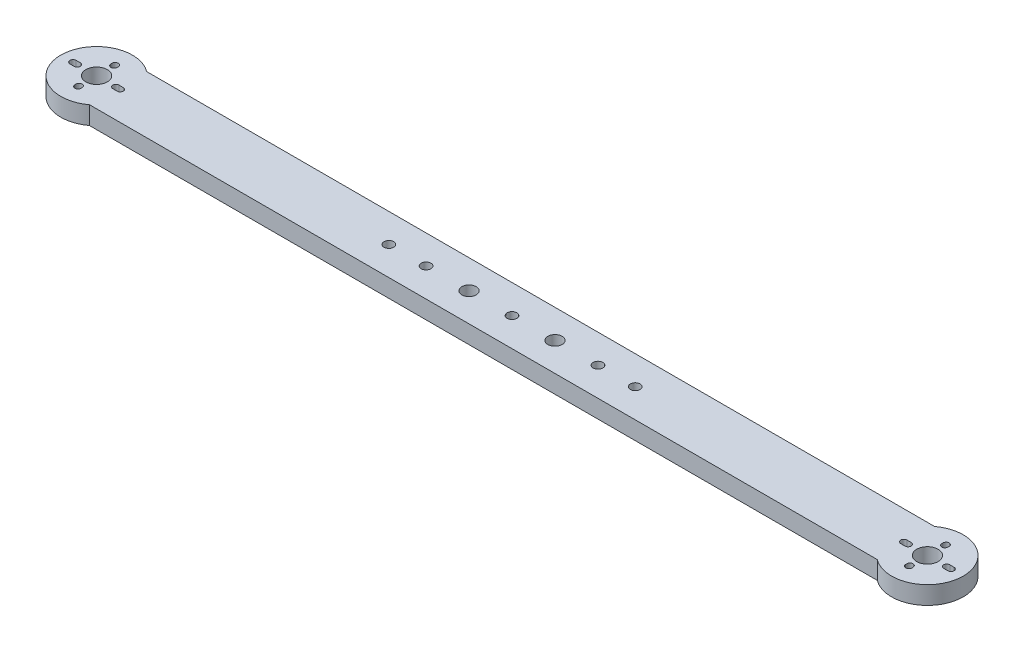
from build123d import *

# Parameters (mm, degrees)
BOSS_EXTRUDE1_DEPTH = 8
SKETCH2_R           = 4.75
CUT_EXTRUDE1_DEPTH  = 201.81338663
SKETCH3_R           = 2.159
CUT_EXTRUDE2_DEPTH  = 201.81338663
SKETCH4_R           = 3.175
CUT_EXTRUDE3_DEPTH  = 201.81338663
SKETCH5_R           = 2.159
CUT_EXTRUDE4_DEPTH  = 201.81338663


with BuildPart() as part:
    # Sketch1 → Boss-Extrude1 (new body)
    with BuildSketch(Plane(origin=(0, 0, 0), x_dir=(1, 0, 0), z_dir=(0, 1, 0))):
        with BuildLine():
            Line((-174.625, 12.7), (174.625, 12.7))
            ThreePointArc((174.625, 12.7), (200.025, 0), (174.625, -12.7))
            Line((174.625, -12.7), (-174.625, -12.7))
            ThreePointArc((-174.625, -12.7), (-200.025, 0), (-174.625, 12.7))
        make_face()
    extrude(amount=BOSS_EXTRUDE1_DEPTH)

    # Sketch2 → Cut-Extrude1 (cut, through all)
    with BuildSketch(Plane(origin=(0, 8, 0), x_dir=(1, 0, 0), z_dir=(0, 1, 0))):
        with Locations(Location((184.15, 0, 0), (0, 0, 270))):
            Circle(SKETCH2_R)
        with Locations(Location((-184.15, 0, 0), (0, 0, 90))):
            Circle(SKETCH2_R)
        with BuildLine():
            Line((173.691383345, 1.375), (175.608616655, 1.375))
            ThreePointArc((175.608616655, 1.375), (176.983616655, 0), (175.608616655, -1.375))
            Line((175.608616655, -1.375), (173.691383345, -1.375))
            ThreePointArc((173.691383345, -1.375), (172.316383345, 0), (173.691383345, 1.375))
        make_face()
        with BuildLine():
            Line((194.608616655, 1.375), (192.691383345, 1.375))
            ThreePointArc((192.691383345, 1.375), (191.316383345, 0), (192.691383345, -1.375))
            Line((192.691383345, -1.375), (194.608616655, -1.375))
            ThreePointArc((194.608616655, -1.375), (195.983616655, 0), (194.608616655, 1.375))
        make_face()
        with BuildLine():
            Line((185.525, 8.25), (185.525, 7.75))
            ThreePointArc((185.525, 7.75), (184.15, 6.375), (182.775, 7.75))
            Line((182.775, 7.75), (182.775, 8.25))
            ThreePointArc((182.775, 8.25), (184.15, 9.625), (185.525, 8.25))
        make_face()
        with BuildLine():
            Line((185.525, -8.25), (185.525, -7.75))
            ThreePointArc((185.525, -7.75), (184.15, -6.375), (182.775, -7.75))
            Line((182.775, -7.75), (182.775, -8.25))
            ThreePointArc((182.775, -8.25), (184.15, -9.625), (185.525, -8.25))
        make_face()
        with BuildLine():
            Line((-185.525, -8.25), (-185.525, -7.75))
            ThreePointArc((-185.525, -7.75), (-184.15, -6.375), (-182.775, -7.75))
            Line((-182.775, -7.75), (-182.775, -8.25))
            ThreePointArc((-182.775, -8.25), (-184.15, -9.625), (-185.525, -8.25))
        make_face()
        with BuildLine():
            Line((-185.525, 8.25), (-185.525, 7.75))
            ThreePointArc((-185.525, 7.75), (-184.15, 6.375), (-182.775, 7.75))
            Line((-182.775, 7.75), (-182.775, 8.25))
            ThreePointArc((-182.775, 8.25), (-184.15, 9.625), (-185.525, 8.25))
        make_face()
        with BuildLine():
            Line((-194.608616655, 1.375), (-192.691383345, 1.375))
            ThreePointArc((-192.691383345, 1.375), (-191.316383345, 0), (-192.691383345, -1.375))
            Line((-192.691383345, -1.375), (-194.608616655, -1.375))
            ThreePointArc((-194.608616655, -1.375), (-195.983616655, 0), (-194.608616655, 1.375))
        make_face()
        with BuildLine():
            Line((-173.691383345, 1.375), (-175.608616655, 1.375))
            ThreePointArc((-175.608616655, 1.375), (-176.983616655, 0), (-175.608616655, -1.375))
            Line((-175.608616655, -1.375), (-173.691383345, -1.375))
            ThreePointArc((-173.691383345, -1.375), (-172.316383345, 0), (-173.691383345, 1.375))
        make_face()
    extrude(amount=-CUT_EXTRUDE1_DEPTH, mode=Mode.SUBTRACT)

    # Sketch3 → Cut-Extrude2 (cut, through all)
    with BuildSketch(Plane(origin=(0, 8, 0), x_dir=(1, 0, 0), z_dir=(0, 1, 0))):
        with Locations(Location((0, 0, 0), (0, 0, 270))):
            Circle(SKETCH3_R)
        with Locations(Location((38.1, 0, 0), (0, 0, 270))):
            Circle(SKETCH3_R)
        with Locations(Location((-38.1, 0, 0), (0, 0, 270))):
            Circle(SKETCH3_R)
    extrude(amount=-CUT_EXTRUDE2_DEPTH, mode=Mode.SUBTRACT)

    # Sketch4 → Cut-Extrude3 (cut, through all)
    with BuildSketch(Plane(origin=(0, 8, 0), x_dir=(1, 0, 0), z_dir=(0, 1, 0))):
        with Locations(Location((-19.05, 0, 0), (0, 0, 270))):
            Circle(SKETCH4_R)
        with Locations(Location((19.05, 0, 0), (0, 0, 270))):
            Circle(SKETCH4_R)
    extrude(amount=-CUT_EXTRUDE3_DEPTH, mode=Mode.SUBTRACT)

    # Sketch5 → Cut-Extrude4 (cut, through all)
    with BuildSketch(Plane(origin=(0, 8, 0), x_dir=(1, 0, 0), z_dir=(0, 1, 0))):
        with Locations(Location((54.61, 0, 0), (0, 0, 270))):
            Circle(SKETCH5_R)
        with Locations(Location((-54.61, 0, 0), (0, 0, 90))):
            Circle(SKETCH5_R)
    extrude(amount=-CUT_EXTRUDE4_DEPTH, mode=Mode.SUBTRACT)


solid = part.part
